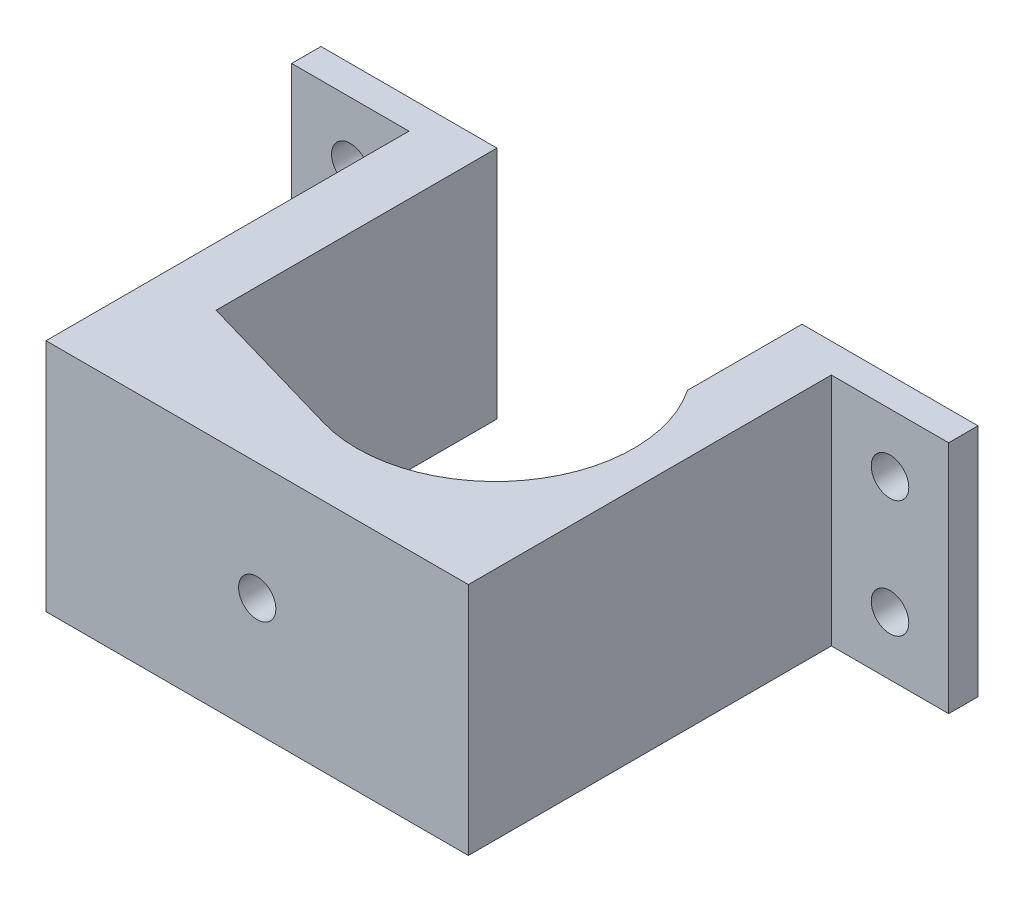
from build123d import *

# Parameters (mm, degrees)
BOSS_EXTRUDE1_DEPTH    = 25.4
SKETCH2_R              = 2.032
CUT_EXTRUDE1_DEPTH     = 62.309334692
F_10_32_TAPPED_HOLE1_D = 4.0386


with BuildPart() as part:
    # Sketch1 → Boss-Extrude1 (new body)
    with BuildSketch(Plane(origin=(0, 0, 0), x_dir=(1, 0, 0), z_dir=(0, 1, 0))):
        with BuildLine():
            Line((-20.574, -9.652129604), (-4.162019583, -14.39674322))
            ThreePointArc((-4.162019583, -14.39674322), (12.103082443, -8.837647749), (12.446, 8.347796497))
            Line((12.446, 8.347796497), (12.446, 20.746712887))
            Line((12.446, 20.746712887), (31.496, 20.746712887))
            Line((31.496, 20.746712887), (31.496, 17.571712887))
            Line((31.496, 17.571712887), (18.796, 17.571712887))
            Line((18.796, 17.571712887), (18.796, -12.827129604))
            Line((18.796, -12.827129604), (18.796, -21.717129604))
            Line((18.796, -21.717129604), (-26.924, -21.717129604))
            Line((-26.924, -21.717129604), (-26.924, -12.827129604))
            Line((-26.924, -12.827129604), (-26.924, 17.571712887))
            Line((-26.924, 17.571712887), (-39.624, 17.571712887))
            Line((-39.624, 17.571712887), (-39.624, 20.746712887))
            Line((-39.624, 20.746712887), (-20.574, 20.746712887))
            Line((-20.574, 20.746712887), (-20.574, 9.652))
            Line((-20.574, 9.652), (-20.574, -9.652129604))
        make_face()
    extrude(amount=BOSS_EXTRUDE1_DEPTH)

    # Sketch2 → Cut-Extrude1 (cut, through all)
    with BuildSketch(Plane.XY.offset(-17.571712887)):
        with Locations((-33.274, 19.05)):
            Circle(SKETCH2_R)
        with Locations((-33.274, 6.35)):
            Circle(SKETCH2_R)
        with Locations((25.146, 19.05)):
            Circle(SKETCH2_R)
        with Locations((25.146, 6.35)):
            Circle(SKETCH2_R)
    extrude(amount=-CUT_EXTRUDE1_DEPTH, mode=Mode.SUBTRACT)

    # #10-32 Tapped Hole1 (through all)
    with Locations(Plane.XY.offset(21.717129604)):
        with Locations((-4.064, 12.7)):
            Hole(F_10_32_TAPPED_HOLE1_D / 2)


solid = part.part
